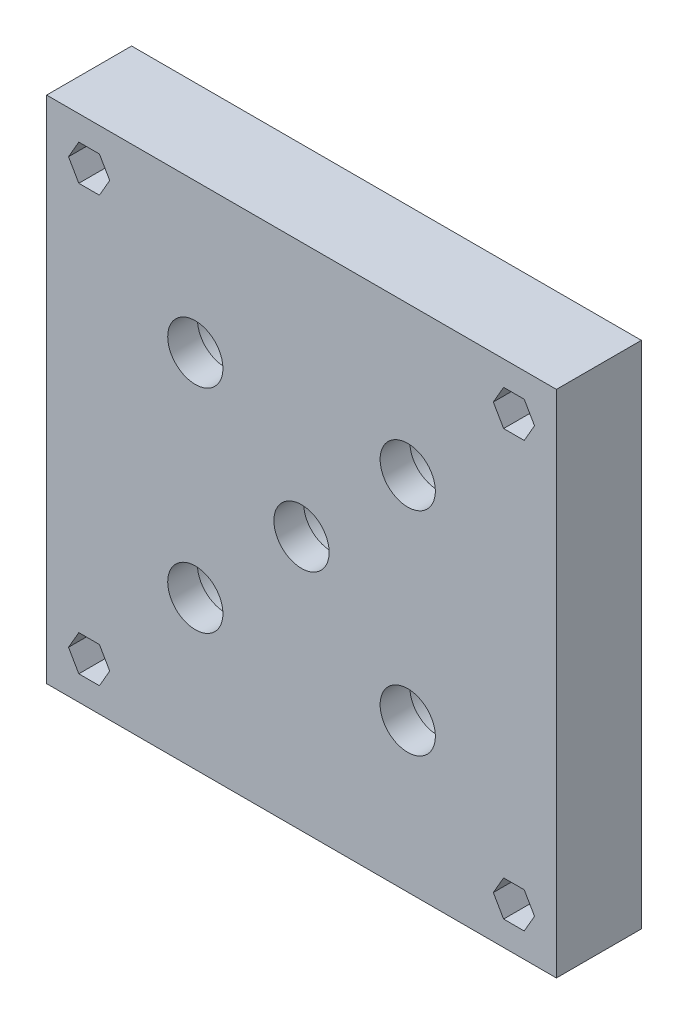
from build123d import *

# Parameters (mm, degrees)
SKETCH1_W           = 60
SKETCH1_H           = 60
BOSS_EXTRUDE1_DEPTH = 10
SKETCH2_R           = 1.15
CUT_EXTRUDE1_DEPTH  = 44.588989435
SKETCH3_R           = 1.15
CUT_EXTRUDE2_DEPTH  = 8
SKETCH5_R           = 5.25
CUT_EXTRUDE4_DEPTH  = 6.5
SKETCH6_R           = 3.25
CUT_EXTRUDE5_DEPTH  = 43.921439864


with BuildPart() as part:
    # Sketch1 → Boss-Extrude1 (new body)
    with BuildSketch(Plane.XY):
        Rectangle(SKETCH1_W, SKETCH1_H)
    extrude(amount=BOSS_EXTRUDE1_DEPTH)

    # Sketch2 → Cut-Extrude1 (cut, through all)
    with BuildSketch(Plane.XY.offset(10)):
        with BuildLine():
            ThreePointArc((-25, 26.15), (-26.15, 25), (-25, 23.85))
            Line((-25, 23.85), (-25, 26.15))
        make_face()
        with BuildLine():
            Line((-25, 26.15), (-25, 23.85))
            ThreePointArc((-25, 23.85), (-24.186827202, 24.186827202), (-23.85, 25))
            ThreePointArc((-23.85, 25), (-24.186827202, 25.813172798), (-25, 26.15))
        make_face()
        with Locations((25, 25)):
            Circle(SKETCH2_R)
        with Locations((25, -25)):
            Circle(SKETCH2_R)
        with Locations((-25, -25)):
            Circle(SKETCH2_R)
    extrude(amount=-CUT_EXTRUDE1_DEPTH, mode=Mode.SUBTRACT)

    # Sketch3 → Cut-Extrude2 (cut)
    # profile 1 of 4: a face of its own
    with BuildSketch(Plane.XY.offset(10)):
        Polygon((-26.212435565, 22.9), (-23.787564435, 22.9), (-22.575128869, 25), (-23.787564435, 27.1), (-26.212435565, 27.1), (-27.424871131, 25), align=None)
        with Locations((-25, 25)):
            Circle(SKETCH3_R, mode=Mode.SUBTRACT)
    # profile 2 of 4: a face of its own
    with BuildSketch(Plane.XY.offset(10)):
        Polygon((22.575128869, 25), (23.787564435, 27.1), (26.212435565, 27.1), (27.424871131, 25), (26.212435565, 22.9), (23.787564435, 22.9), align=None)
        with Locations((25, 25)):
            Circle(SKETCH3_R, mode=Mode.SUBTRACT)
    # profile 3 of 4: a face of its own
    with BuildSketch(Plane.XY.offset(10)):
        Polygon((26.212435565, -22.9), (23.787564435, -22.9), (22.575128869, -25), (23.787564435, -27.1), (26.212435565, -27.1), (27.424871131, -25), align=None)
        with Locations((25, -25)):
            Circle(SKETCH3_R, mode=Mode.SUBTRACT)
    # profile 4 of 4: a face of its own
    with BuildSketch(Plane.XY.offset(10)):
        Polygon((-22.575128869, -25), (-23.787564435, -27.1), (-26.212435565, -27.1), (-27.424871131, -25), (-26.212435565, -22.9), (-23.787564435, -22.9), align=None)
        with Locations((-25, -25)):
            Circle(SKETCH3_R, mode=Mode.SUBTRACT)
    extrude(amount=-CUT_EXTRUDE2_DEPTH, mode=Mode.SUBTRACT)

    # Sketch5 → Cut-Extrude4 (cut)
    with BuildSketch(Plane(origin=(0, 0, 0), x_dir=(-1, 0, 0), z_dir=(0, 0, -1))):
        with Locations((-12.5, 12.5)):
            Circle(SKETCH5_R)
        with Locations((12.5, 12.5)):
            Circle(SKETCH5_R)
        Circle(SKETCH5_R)
        with Locations((-12.5, -12.5)):
            Circle(SKETCH5_R)
        with Locations((12.5, -12.5)):
            Circle(SKETCH5_R)
    extrude(amount=-CUT_EXTRUDE4_DEPTH, mode=Mode.SUBTRACT)

    # Sketch6 → Cut-Extrude5 (cut, through all)
    with BuildSketch(Plane(origin=(0, 0, 6.5), x_dir=(-1, 0, 0), z_dir=(0, 0, -1))):
        with Locations((-12.5, 12.5)):
            Circle(SKETCH6_R)
        with Locations((12.5, 12.5)):
            Circle(SKETCH6_R)
        Circle(SKETCH6_R)
        with Locations((-12.5, -12.5)):
            Circle(SKETCH6_R)
        with Locations((12.5, -12.5)):
            Circle(SKETCH6_R)
    extrude(amount=-CUT_EXTRUDE5_DEPTH, mode=Mode.SUBTRACT)


solid = part.part
